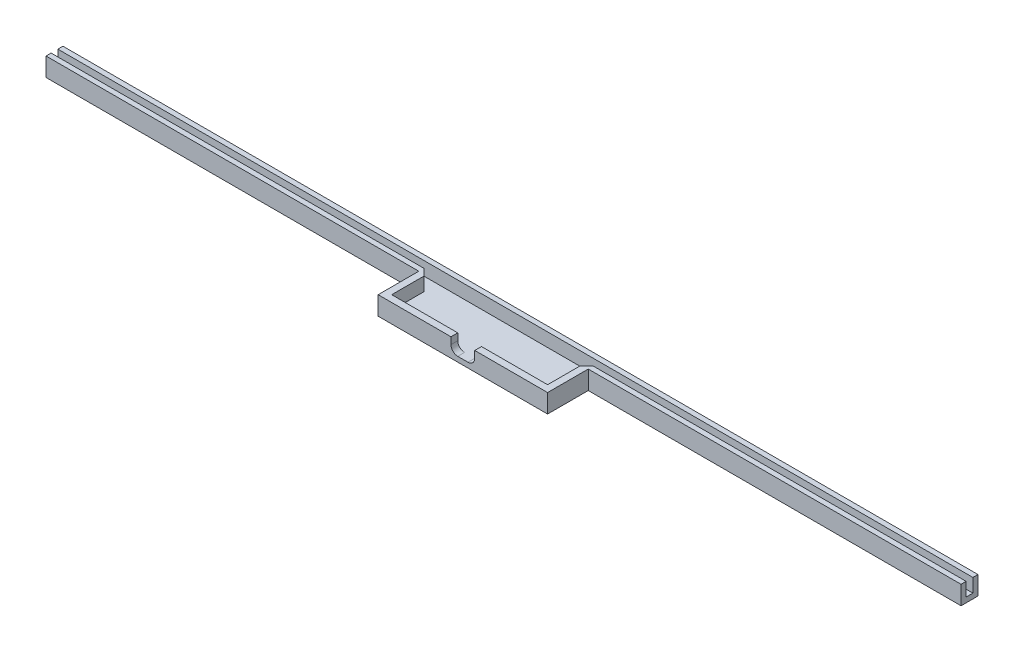
from build123d import *

# Parameters (mm, degrees)
BOSS_EXTRUDE1_DEPTH = 1.5
SKETCH3_W           = 270
SKETCH3_H           = 1.5
BOSS_EXTRUDE2_DEPTH = 4
SKETCH4_W           = 110
SKETCH4_H           = 1.5
BOSS_EXTRUDE3_DEPTH = 4
SKETCH6_W           = 2
SKETCH6_H           = 13.5
BOSS_EXTRUDE5_DEPTH = 4
SKETCH7_W           = 19.5
SKETCH7_H           = 2
BOSS_EXTRUDE6_DEPTH = 4
CHAMFER1_SIZE       = 2
FILLET1_R           = 2


with BuildPart() as part:
    # Sketch1 → Boss-Extrude1 (new body)
    with BuildSketch(Plane(origin=(0, 0, 0), x_dir=(1, 0, 0), z_dir=(0, 1, 0))):
        Polygon((25, 8.5), (135, 8.5), (135, 3.5), (25, 3.5), (25, -8.5), (-25, -8.5), (-25, 3.5), (-135, 3.5), (-135, 8.5), (-25, 8.5), align=None)
    extrude(amount=BOSS_EXTRUDE1_DEPTH)

    # Sketch3 → Boss-Extrude2 (add)
    with BuildSketch(Plane(origin=(0, 1.5, 0), x_dir=(1, 0, 0), z_dir=(0, 1, 0))):
        with Locations((0, 7.75)):
            Rectangle(SKETCH3_W, SKETCH3_H)
    boss_extrude2 = extrude(amount=BOSS_EXTRUDE2_DEPTH)

    # Sketch4 → Boss-Extrude3 (add)
    with BuildSketch(Plane(origin=(0, 1.5, 0), x_dir=(1, 0, 0), z_dir=(0, 1, 0))):
        with Locations((-80, 4.25)):
            Rectangle(SKETCH4_W, SKETCH4_H)
    boss_extrude3 = extrude(amount=BOSS_EXTRUDE3_DEPTH)

    # Mirror1: Boss-Extrude2, Boss-Extrude3 across plane
    add(boss_extrude2.mirror(Plane(origin=(0, 0, 0), x_dir=(0, 0, 1), z_dir=(1, 0, 0))))
    add(boss_extrude3.mirror(Plane(origin=(0, 0, 0), x_dir=(0, 0, 1), z_dir=(1, 0, 0))))

    # Sketch6 → Boss-Extrude5 (add)
    with BuildSketch(Plane(origin=(0, 1.5, 0), x_dir=(1, 0, 0), z_dir=(0, 1, 0))):
        with Locations((-24, -1.75)):
            Rectangle(SKETCH6_W, SKETCH6_H)
        with Locations((24, -1.75)):
            Rectangle(SKETCH6_W, SKETCH6_H)
    extrude(amount=BOSS_EXTRUDE5_DEPTH)

    # Sketch7 → Boss-Extrude6 (add)
    with BuildSketch(Plane(origin=(0, 1.5, 0), x_dir=(1, 0, 0), z_dir=(0, 1, 0))):
        with Locations((-13.25, -7.5)):
            Rectangle(SKETCH7_W, SKETCH7_H)
        with Locations((13.25, -7.5)):
            Rectangle(SKETCH7_W, SKETCH7_H)
    extrude(amount=BOSS_EXTRUDE6_DEPTH)

    # Chamfer1
    chamfer1_edges = [part.edges().sort_by_distance(p)[0] for p in [
        (-23, 3.5, -5),
        (23, 3.5, -5),
    ]]
    chamfer(chamfer1_edges, length=CHAMFER1_SIZE)

    # Fillet1
    fillet1_edges = [part.edges().sort_by_distance(p)[0] for p in [
        (-3.5, 1.5, 7.5),
        (3.5, 1.5, 7.5),
    ]]
    fillet(fillet1_edges, radius=FILLET1_R)


solid = part.part
